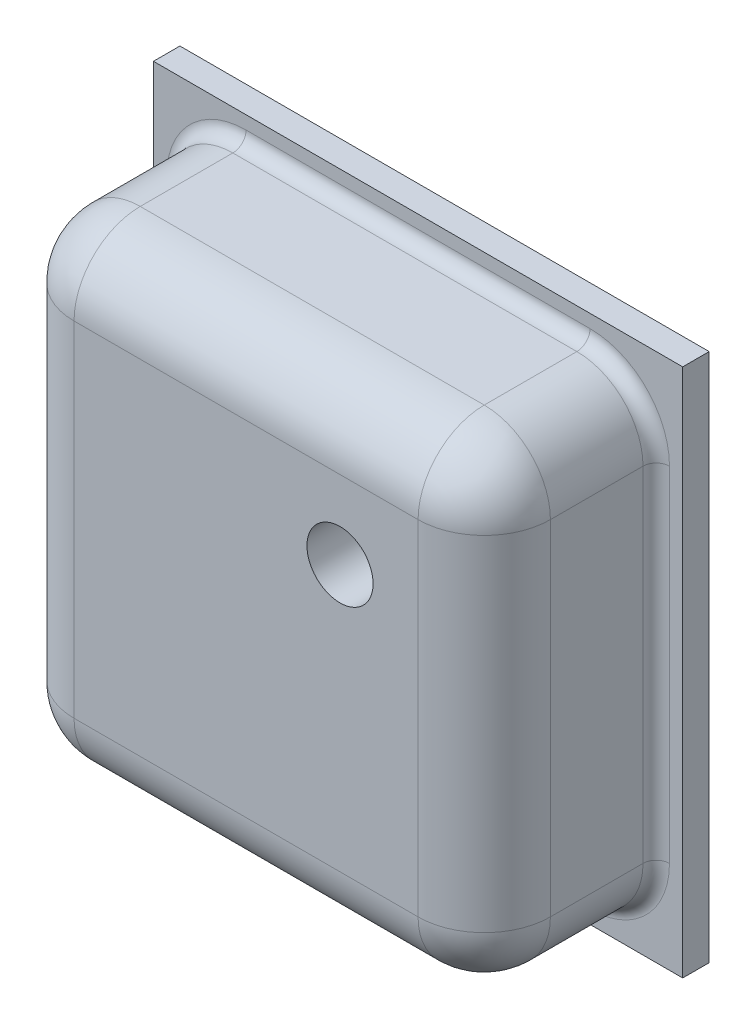
from build123d import *

# Parameters (mm, degrees)
ESQUISSE1_W   = 2
ESQUISSE1_H   = 2
SEMELLE_DEPTH = 0.1
ESQUISSE2_W   = 1.8
ESQUISSE2_H   = 1.8
CORP_DEPTH    = 0.75
ESQUISSE3_R   = 0.125
EVENT_DEPTH   = 0.65
CONGE_TOP_R   = 0.25
CONG_BASE_R   = 0.05


with BuildPart() as part:
    # Esquisse1 → semelle (new body)
    with BuildSketch(Plane.XY):
        Rectangle(ESQUISSE1_W, ESQUISSE1_H)
    extrude(amount=SEMELLE_DEPTH)

    # Esquisse2 → corp (add)
    with BuildSketch(Plane.XY):
        Rectangle(ESQUISSE2_W, ESQUISSE2_H)
    extrude(amount=CORP_DEPTH)

    # Esquisse3 → event (cut)
    with BuildSketch(Plane.XY.offset(0.75)):
        with Locations((0.355, 0.355)):
            Circle(ESQUISSE3_R)
    extrude(amount=-EVENT_DEPTH, mode=Mode.SUBTRACT)

    # conge top
    conge_top_edges = [part.edges().sort_by_distance(p)[0] for p in [
        (-0.9, -0.9, 0.425),
        (0.9, -0.9, 0.425),
        (0.9, 0.9, 0.425),
        (-0.9, 0.9, 0.425),
        (0, -0.9, 0.75),
        (0.9, 0, 0.75),
        (0, 0.9, 0.75),
        (-0.9, 0, 0.75),
    ]]
    fillet(conge_top_edges, radius=CONGE_TOP_R)

    # Congé base
    cong_base_edges = [part.edges().sort_by_distance(p)[0] for p in [
        (0, -0.9, 0.1),
        (0.9, 0, 0.1),
        (0, 0.9, 0.1),
        (-0.9, 0, 0.1),
        (-0.826776695, 0.826776695, 0.1),
        (-0.826776695, -0.826776695, 0.1),
        (0.826776695, 0.826776695, 0.1),
        (0.826776695, -0.826776695, 0.1),
    ]]
    fillet(cong_base_edges, radius=CONG_BASE_R)


solid = part.part
